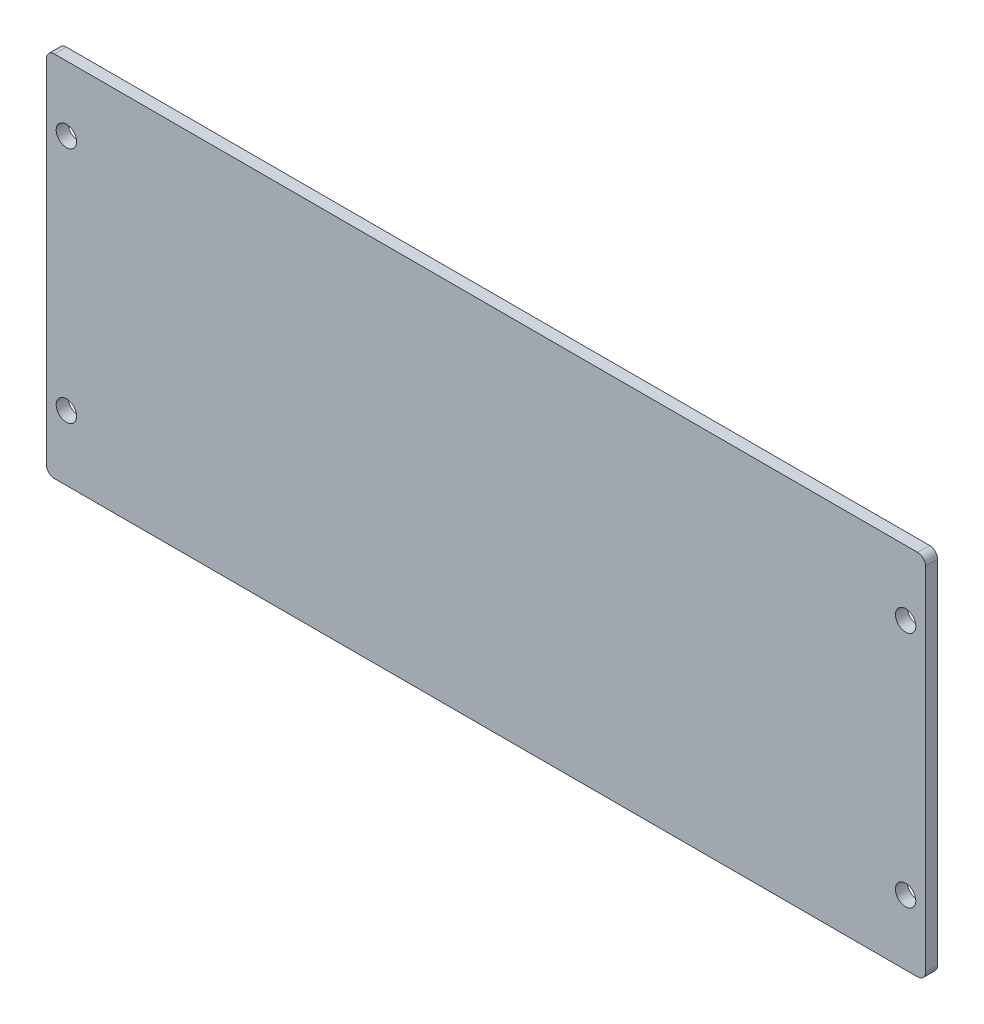
from build123d import *

# Parameters (mm, degrees)
SKETCH1_R           = 2.55
BOSS_EXTRUDE1_DEPTH = 3
FILLET1_R           = 2


with BuildPart() as part:
    # Sketch1 → Boss-Extrude1 (new body)
    with BuildSketch(Plane.XY):
        Polygon((-100, 96), (100, 96), (110, 96), (110, 4), (-110, 4), (-110, 96), align=None)
        with Locations((105, 20.245379956)):
            Circle(SKETCH1_R, mode=Mode.SUBTRACT)
        with Locations((105, 79.754620044)):
            Circle(SKETCH1_R, mode=Mode.SUBTRACT)
        with Locations((-105, 20.245379956)):
            Circle(SKETCH1_R, mode=Mode.SUBTRACT)
        with Locations((-105, 79.754620044)):
            Circle(SKETCH1_R, mode=Mode.SUBTRACT)
    extrude(amount=BOSS_EXTRUDE1_DEPTH)

    # Fillet1
    fillet1_edges = [part.edges().sort_by_distance(p)[0] for p in [
        (110, 4, 1.5),
        (-110, 4, 1.5),
        (-110, 96, 1.5),
        (110, 96, 1.5),
    ]]
    fillet(fillet1_edges, radius=FILLET1_R)


solid = part.part
